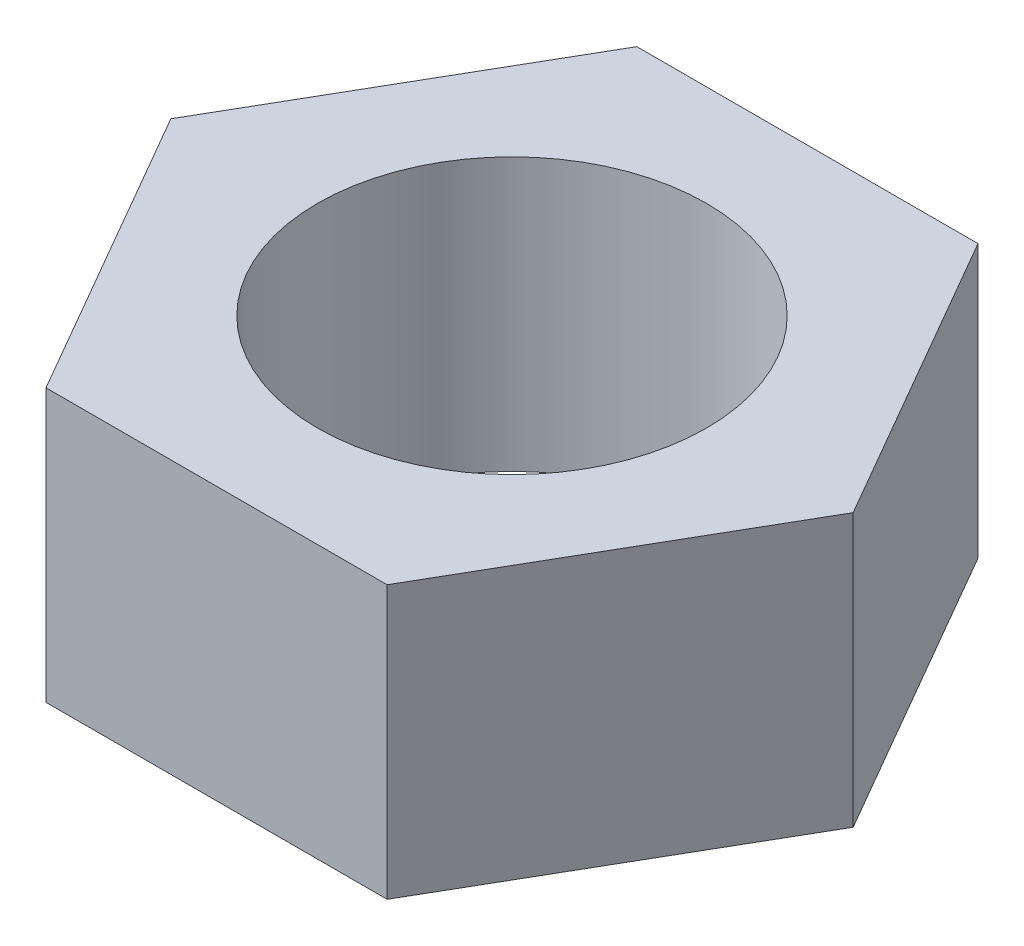
from build123d import *

# Parameters (mm, degrees)
SKETCH1_R           = 5.5
BOSS_EXTRUDE1_DEPTH = 7.7


with BuildPart() as part:
    # Sketch1 → Boss-Extrude1 (new body)
    with BuildSketch(Plane(origin=(0, 0, 0), x_dir=(1, 0, 0), z_dir=(0, 1, 0))):
        Polygon((4.820874748, -8.35), (9.641749495, 0), (4.820874748, 8.35), (-4.820874748, 8.35), (-9.641749495, 0), (-4.820874748, -8.35), align=None)
        with Locations(Location((0, 0, 0), (0, 0, 90))):
            Circle(SKETCH1_R, mode=Mode.SUBTRACT)
    extrude(amount=BOSS_EXTRUDE1_DEPTH)


solid = part.part
